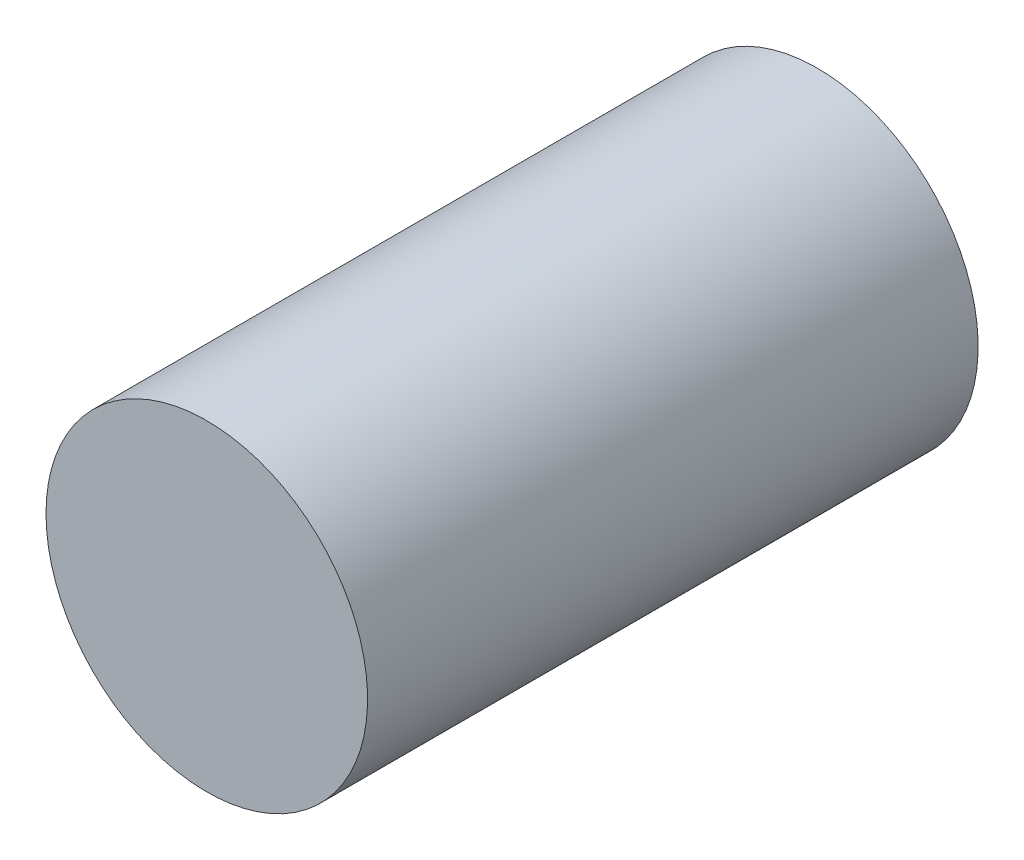
from build123d import *

# Parameters (mm, degrees)
SKETCH1_R           = 40.132
BOSS_EXTRUDE1_DEPTH = 152.4


with BuildPart() as part:
    # Sketch1 → Boss-Extrude1 (new body)
    with BuildSketch(Plane.XY):
        with Locations(Location((0, 0, 0), (0, 0, 180))):
            Circle(SKETCH1_R)
    extrude(amount=BOSS_EXTRUDE1_DEPTH)


solid = part.part
